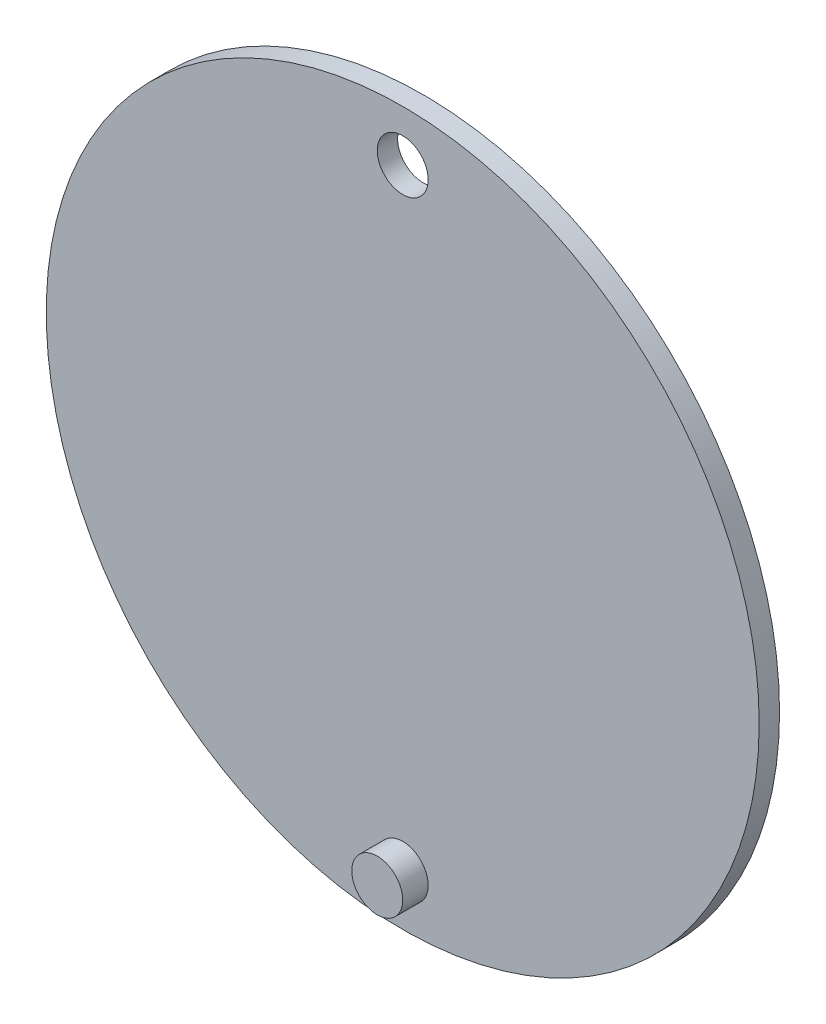
from build123d import *

# Parameters (mm, degrees)
SKETCH1_R           = 88.9
SKETCH1_R_2         = 6.35
BOSS_EXTRUDE1_DEPTH = 5.08
SKETCH2_R           = 6.35
BOSS_EXTRUDE2_DEPTH = 11.43
BOSS_EXTRUDE3_START = -50.8
SKETCH3_R           = 6.35
BOSS_EXTRUDE3_DEPTH = 50.8


with BuildPart() as part:
    # Sketch1 → Boss-Extrude1 (new body)
    with BuildSketch(Plane.XY):
        Circle(SKETCH1_R)
        Circle(SKETCH1_R_2, mode=Mode.SUBTRACT)
        with Locations((0, -76.2)):
            Circle(SKETCH1_R_2, mode=Mode.SUBTRACT)
        with Locations((0, 76.2)):
            Circle(SKETCH1_R_2, mode=Mode.SUBTRACT)
    extrude(amount=BOSS_EXTRUDE1_DEPTH)

    # Sketch2 → Boss-Extrude2 (add)
    with BuildSketch(Plane.XY):
        with Locations((0, -76.2)):
            Circle(SKETCH2_R)
    extrude(amount=BOSS_EXTRUDE2_DEPTH)

    # Sketch3 → Boss-Extrude3 (add)
    with BuildSketch(Plane.XY.offset(5.08).offset(BOSS_EXTRUDE3_START)):
        Circle(SKETCH3_R)
    extrude(amount=BOSS_EXTRUDE3_DEPTH)


solid = part.part
